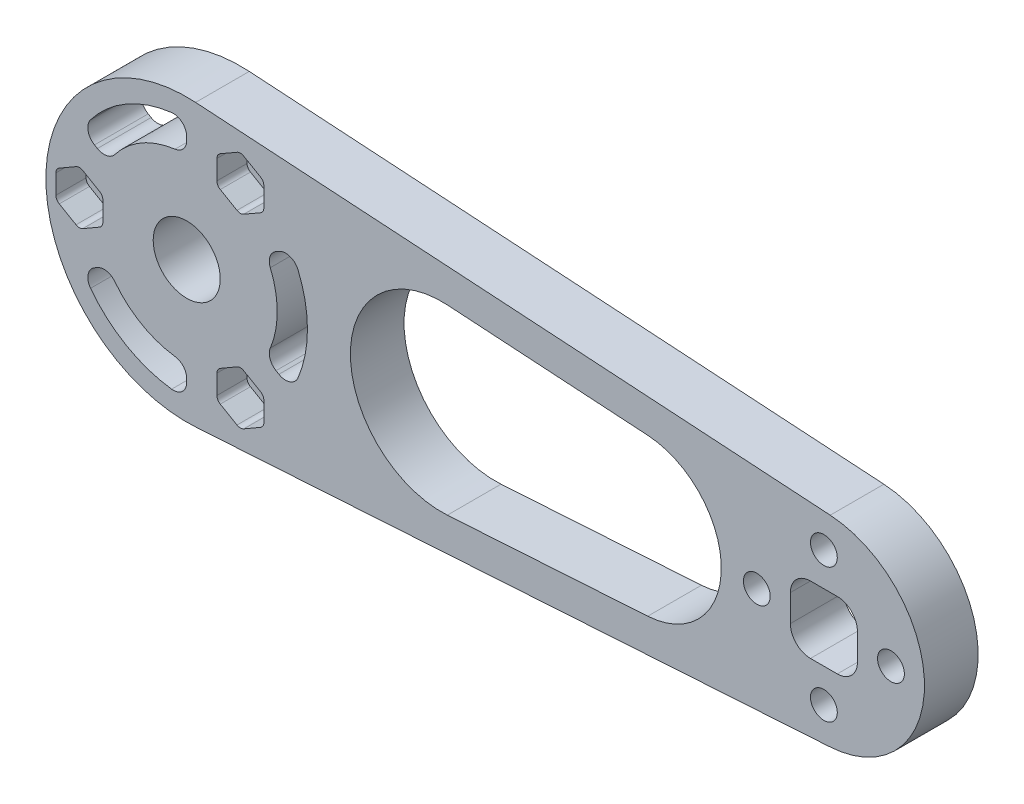
from build123d import *

# Parameters (mm, degrees)
SKETCH_1_R           = 21
SKETCH_1_R_2         = 2
EXTRUDE_1_DEPTH      = 8
EXTRUDE_START        = -7
SKETCH_1_3_R         = 20
SKETCH_1_3_R_2       = 2
EXTRUDE_2_DEPTH      = 7
SKETCH_3_R           = 5
CUT_EXTRUDE_10_DEPTH = 25
CUT_EXTRUDE_11_DEPTH = 25
FILLET_8_R           = 2
EXTRUDE_START_2      = -8
EXTRUDE_4_DEPTH      = 8
SKETCH_14_R          = 2
CUT_EXTRUDE_13_DEPTH = 8
SKETCH_15_W          = 10
SKETCH_15_H          = 10
CUT_EXTRUDE_14_DEPTH = 20
CUT_EXTRUDE_START    = 26
SKETCH_16_R          = 20
CUT_EXTRUDE_15_DEPTH = 26
CUT_EXTRUDE_16_DEPTH = 4.5
CUT_EXTRUDE_17_DEPTH = 10
FILLET_9_R           = 1
FILLET_10_R          = 3


with BuildPart() as part:
    # 草图1 → 凸台-拉伸1 (new body)
    with BuildSketch(Plane.XY):
        Circle(SKETCH_1_R)
        with Locations((8, 13.856406461)):
            Circle(SKETCH_1_R_2, mode=Mode.SUBTRACT)
        with Locations((8, -13.856406461)):
            Circle(SKETCH_1_R_2, mode=Mode.SUBTRACT)
        with Locations((-16, 0)):
            Circle(SKETCH_1_R_2, mode=Mode.SUBTRACT)
    extrude(amount=EXTRUDE_1_DEPTH)

    # 草图1<3> → 凸台-拉伸2 (add)
    with BuildSketch(Plane.XY.offset(EXTRUDE_START)):
        Circle(SKETCH_1_3_R)
        with Locations((8, -13.856406461)):
            Circle(SKETCH_1_3_R_2, mode=Mode.SUBTRACT)
        with Locations((-16, 0)):
            Circle(SKETCH_1_3_R_2, mode=Mode.SUBTRACT)
        with Locations((8, 13.856406461)):
            Circle(SKETCH_1_3_R_2, mode=Mode.SUBTRACT)
    extrude(amount=EXTRUDE_2_DEPTH)

    # 草图3 → 切除-拉伸10 (cut)
    with BuildSketch(Plane(origin=(0, 0, -7), x_dir=(-1, 0, 0), z_dir=(0, 0, -1))):
        Circle(SKETCH_3_R)
    extrude(amount=-CUT_EXTRUDE_10_DEPTH, mode=Mode.SUBTRACT)

    # 草图7 → 切除-拉伸11 (cut)
    with BuildSketch(Plane(origin=(0, 0, -7), x_dir=(-1, 0, 0), z_dir=(0, 0, -1))):
        with BuildLine():
            Line((0, 13.5), (0, 18))
            ThreePointArc((0, 18), (9, 15.588457268), (15.588457268, 9))
            Line((15.588457268, 9), (11.691342951, 6.75))
            ThreePointArc((11.691342951, 6.75), (6.75, 11.691342951), (0, 13.5))
        make_face()
        with BuildLine():
            Line((11.691342951, -6.75), (15.588457268, -9))
            ThreePointArc((15.588457268, -9), (9, -15.588457268), (0, -18))
            Line((0, -18), (0, -13.5))
            ThreePointArc((0, -13.5), (6.75, -11.691342951), (11.691342951, -6.75))
        make_face()
        with BuildLine():
            Line((-11.691342951, -6.75), (-15.588457268, -9))
            ThreePointArc((-15.588457268, -9), (-18, 0), (-15.588457268, 9))
            Line((-15.588457268, 9), (-11.691342951, 6.75))
            ThreePointArc((-11.691342951, 6.75), (-13.5, 0), (-11.691342951, -6.75))
        make_face()
    extrude(amount=-CUT_EXTRUDE_11_DEPTH, mode=Mode.SUBTRACT)

    # 圆角8
    fillet_8_edges = [part.edges().sort_by_distance(p)[0] for p in [
        (0, 13.5, 0.5),
        (0, 18, 0.5),
        (0, -18, 0.5),
        (0, -13.5, 0.5),
        (-11.691342951, -6.75, 0.5),
        (-15.588457268, -9, 0.5),
        (15.588457268, 9, 0.5),
        (11.691342951, 6.75, 0.5),
        (11.691342951, -6.75, 0.5),
        (15.588457268, -9, 0.5),
        (-11.691342951, 6.75, 0.5),
        (-15.588457268, 9, 0.5),
    ]]
    fillet(fillet_8_edges, radius=FILLET_8_R)

    # 草图12 → 凸台-拉伸4 (add)
    with BuildSketch(Plane.XY.offset(8).offset(EXTRUDE_START_2)):
        with BuildLine():
            Line((95.947368421, 14.970053209), (1.326315789, 20.958074492))
            ThreePointArc((1.326315789, 20.958074492), (15.310986767, 14.372671436), (21, 0))
            ThreePointArc((21, 0), (15.405284749, -14.271552186), (1.602171257, -20.93879288))
            Line((1.602171257, -20.93879288), (95.75, -14.981238267))
            ThreePointArc((95.75, -14.981238267), (109.999674335, -0.09884255), (95.947368421, 14.970053209))
        make_face()
    extrude(amount=EXTRUDE_4_DEPTH)

    # 草图14 → 切除-拉伸13 (cut)
    with BuildSketch(Plane.XY.offset(8)):
        with Locations((95, 10)):
            Circle(SKETCH_14_R)
        with Locations((105, 0)):
            Circle(SKETCH_14_R)
        with Locations((95, -10)):
            Circle(SKETCH_14_R)
        with Locations((85, 0)):
            Circle(SKETCH_14_R)
    extrude(amount=-CUT_EXTRUDE_13_DEPTH, mode=Mode.SUBTRACT)

    # 草图15 → 切除-拉伸14 (cut)
    with BuildSketch(Plane.XY.offset(8)):
        with Locations((95, 0)):
            Rectangle(SKETCH_15_W, SKETCH_15_H)
    extrude(amount=-CUT_EXTRUDE_14_DEPTH, mode=Mode.SUBTRACT)

    # 草图16 → 切除-拉伸15 (cut)
    with BuildSketch(Plane(origin=(0, 0, 0), x_dir=(-1, 0, 0), z_dir=(0, 0, -1)).offset(CUT_EXTRUDE_START)):
        Circle(SKETCH_16_R)
    extrude(amount=-CUT_EXTRUDE_15_DEPTH, mode=Mode.SUBTRACT)

    # 草图17 → 切除-拉伸16 (cut)
    with BuildSketch(Plane.XY.offset(8)):
        Polygon((4.5, -11.835680518), (4.5, -15.877132403), (8, -17.897858345), (11.5, -15.877132403), (11.5, -11.835680518), (8, -9.814954576), align=None)
        Polygon((8, 9.814954576), (11.5, 11.835680518), (11.5, 15.877132403), (8, 17.897858345), (4.5, 15.877132403), (4.5, 11.835680518), align=None)
        Polygon((-12.5, 2.020725942), (-16, 4.041451884), (-19.5, 2.020725942), (-19.5, -2.020725942), (-16, -4.041451884), (-12.5, -2.020725942), align=None)
    extrude(amount=-CUT_EXTRUDE_16_DEPTH, mode=Mode.SUBTRACT)

    # 草图13 → 切除-拉伸17 (cut)
    with BuildSketch(Plane.XY.offset(8)):
        with BuildLine():
            Line((68.739124089, 11.680451578), (38.858770913, 13.571242245))
            ThreePointArc((38.858770913, 13.571242245), (24.401613936, 0), (38.858770913, -13.571242245))
            Line((38.858770913, -13.571242245), (68.739124089, -11.680451578))
            ThreePointArc((68.739124089, -11.680451578), (79.70381363, 0), (68.739124089, 11.680451578))
        make_face()
    extrude(amount=-CUT_EXTRUDE_17_DEPTH, mode=Mode.SUBTRACT)

    # 圆角9
    fillet_9_edges = [part.edges().sort_by_distance(p)[0] for p in [
        (-12.5, 2.020725942, 5.75),
        (-16, 4.041451884, 5.75),
        (-19.5, 2.020725942, 5.75),
        (-19.5, -2.020725942, 5.75),
        (-16, -4.041451884, 5.75),
        (-12.5, -2.020725942, 5.75),
        (4.5, -11.835680518, 5.75),
        (4.5, -15.877132403, 5.75),
        (8, -17.897858345, 5.75),
        (11.5, -15.877132403, 5.75),
        (11.5, -11.835680518, 5.75),
        (8, -9.814954576, 5.75),
        (8, 9.814954576, 5.75),
        (11.5, 11.835680518, 5.75),
        (4.5, 15.877132403, 5.75),
        (4.5, 11.835680518, 5.75),
        (11.5, 15.877132403, 5.75),
        (8, 17.897858345, 5.75),
    ]]
    fillet(fillet_9_edges, radius=FILLET_9_R)

    # 圆角10
    fillet_10_edges = [part.edges().sort_by_distance(p)[0] for p in [
        (90, -5, 4),
        (100, -5, 4),
        (100, 5, 4),
        (90, 5, 4),
    ]]
    fillet(fillet_10_edges, radius=FILLET_10_R)


solid = part.part
